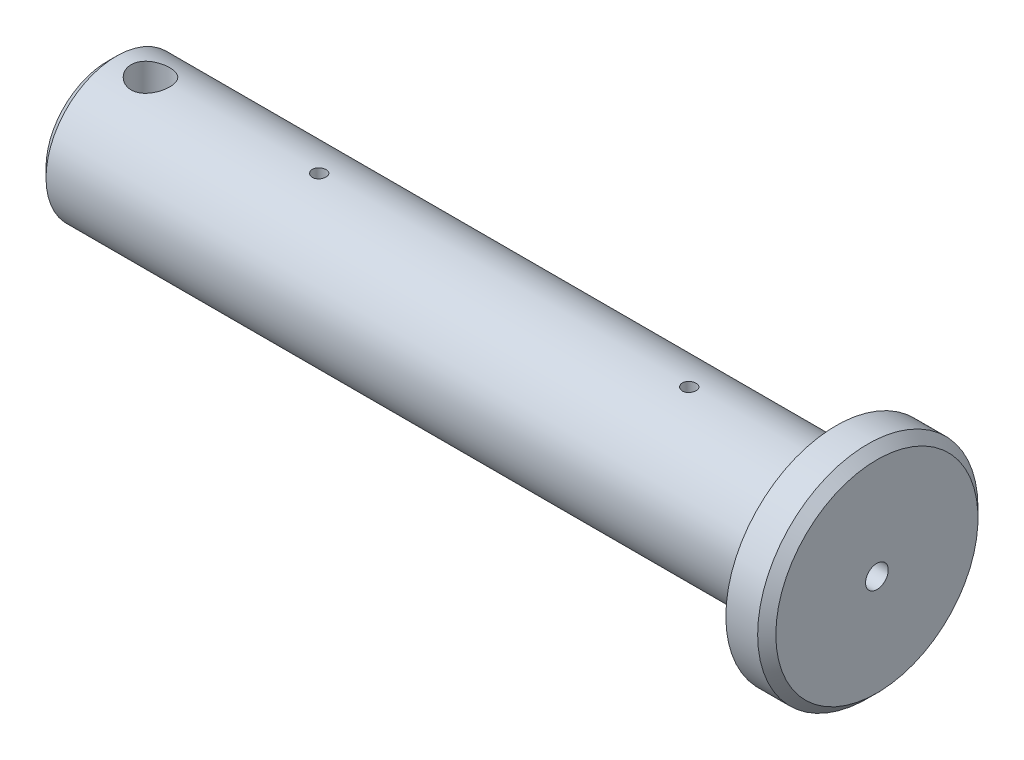
from build123d import *

# Parameters (mm, degrees)
ESBO_O2_R                  = 1.5
CORTE_EXTRUS_O1_DEPTH      = 92.370241873
CORTE_EXTRUS_O2_DEPTH      = 92.370241873
CORTE_EXTRUS_O2_DEPTH_BACK = 92.370241873
ESBO_O3_R                  = 4.25


with BuildPart() as part:
    # Esboço1 → Revolução1 (revolve)
    with BuildSketch(Plane.XY, mode=Mode.PRIVATE) as revolu_o1_sk:
        Polygon((84.69, 2.5), (84.69, 22.25), (82.69, 24.25), (75.69, 24.25), (75.69, 15.5), (-82.69, 15.5), (-84.69, 13.5), (-84.69, 0), (-44.69, 0), (-43.788709071, 1.5), (74.089139381, 1.5), (74.69, 2.5), align=None)
    revolve(revolu_o1_sk.sketch.rotate(Axis((-84.69, 0, 0), (1, 0, 0)), 90), axis=Axis((-84.69, 0, 0), (1, 0, 0)))

    # Esboço2 → Corte-extrusão1 (cut, through all)
    with BuildSketch(Plane(origin=(0, 0, 0), x_dir=(1, 0, 0), z_dir=(0, 1, 0))):
        with Locations(Location((43.39, 0, 0), (0, 0, 90))):
            Circle(ESBO_O2_R)
        with Locations(Location((-38.05, 0, 0), (0, 0, 90))):
            Circle(ESBO_O2_R)
    extrude(amount=CORTE_EXTRUS_O1_DEPTH, mode=Mode.SUBTRACT)

    # Esboço3 → Corte-extrusão2 (cut, two sides: drawn at the far end of the back side and taken through both)
    with BuildSketch(Plane(origin=(0, 0, 0), x_dir=(1, 0, 0), z_dir=(0, 1, 0)).offset(-CORTE_EXTRUS_O2_DEPTH_BACK)):
        with Locations(Location((-75.19, 0, 0), (0, 0, 270))):
            Circle(ESBO_O3_R)
    extrude(amount=CORTE_EXTRUS_O2_DEPTH + CORTE_EXTRUS_O2_DEPTH_BACK, mode=Mode.SUBTRACT)


solid = part.part
